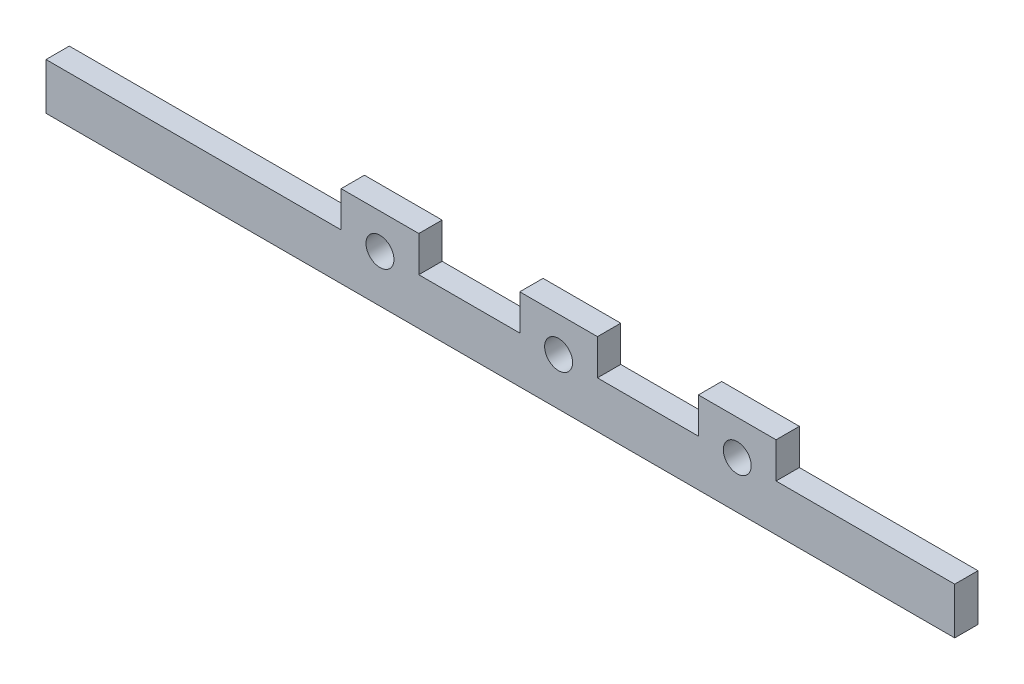
from build123d import *

# Parameters (mm, degrees)
CROQUIS1_R              = 9
SALIENTE_EXTRUIR1_DEPTH = 15


with BuildPart() as part:
    # Croquis1 → Saliente-Extruir1 (new body)
    with BuildSketch(Plane.XY):
        Polygon((-292.5, 0), (292.5, 0), (292.5, 30), (177.5, 30), (177.5, 53), (127.5, 53), (127.5, 30), (62.5, 30), (62.5, 53), (12.5, 53), (12.5, 30), (-52.5, 30), (-52.5, 53), (-102.5, 53), (-102.5, 30), (-292.5, 30), align=None)
        with Locations((37.5, 30.5)):
            Circle(CROQUIS1_R, mode=Mode.SUBTRACT)
        with Locations((-77.5, 30.5)):
            Circle(CROQUIS1_R, mode=Mode.SUBTRACT)
        with Locations((152.5, 30.5)):
            Circle(CROQUIS1_R, mode=Mode.SUBTRACT)
    extrude(amount=SALIENTE_EXTRUIR1_DEPTH)


solid = part.part
